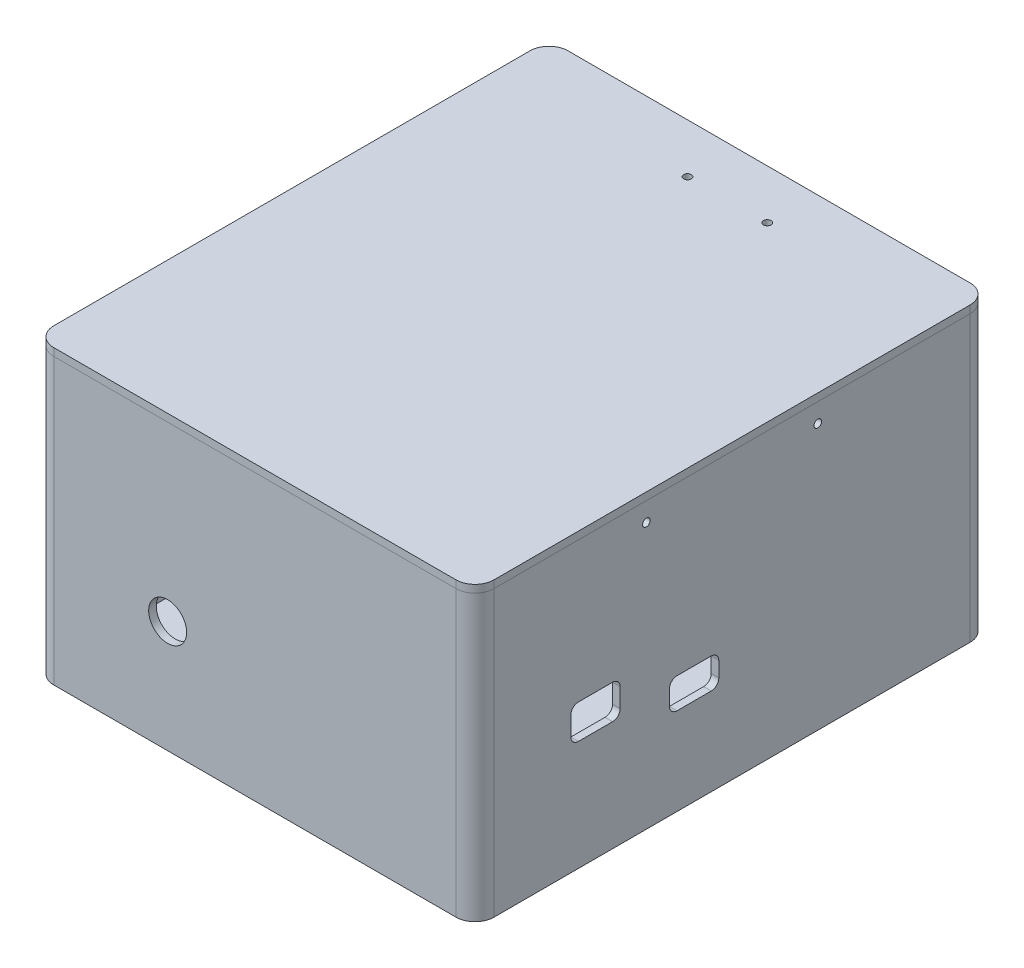
from build123d import *

# Parameters (mm, degrees)
SKETCH1_W               = 116
SKETCH1_H               = 135.5
SKETCH1_R               = 1.625
BOSS_EXTRUDE1_DEPTH     = 2
SKETCH3_W               = 116
SKETCH3_H               = 135.5
SKETCH3_W_2             = 112
SKETCH3_H_2             = 131.5
BOSS_EXTRUDE2_DEPTH     = 73
SKETCH5_W               = 13
SKETCH5_H               = 8
SKETCH5_H_2             = 9
CUT_EXTRUDE1_DEPTH      = 2
SKETCH8_R               = 5
CUT_EXTRUDE2_DEPTH      = 2
FILLET1_R               = 2
FILLET2_R               = 5
CUT_EXTRUDE3_DEPTH      = 136.639227364
CUT_EXTRUDE3_DEPTH_BACK = 136.639227364
SKETCH9_R               = 1
SKETCH10_R              = 4
CUT_EXTRUDE4_DEPTH      = 2
CUT_EXTRUDE5_DEPTH      = 2
BOSS_EXTRUDE4_DEPTH     = 2
SKETCH15_W              = 20
SKETCH15_H              = 29
BOSS_EXTRUDE5_DEPTH     = 2
SKETCH16_R              = 9.5
CUT_EXTRUDE6_DEPTH      = 2
SKETCH17_R              = 9.5
CUT_EXTRUDE7_DEPTH      = 2
SKETCH18_W              = 3
SKETCH18_H              = 75.5
BOSS_EXTRUDE6_DEPTH     = 10
BOSS_EXTRUDE6_2_DEPTH   = 10
SKETCH19_W              = 116
SKETCH19_H              = 135.5
BOSS_EXTRUDE7_DEPTH     = 2
FILLET3_R               = 5
SKETCH21_R              = 1
CUT_EXTRUDE8_DEPTH      = 2
CUT_EXTRUDE9_DEPTH      = 137.75525584
CUT_EXTRUDE9_DEPTH_BACK = 137.75525584
SKETCH22_R              = 1
SKETCH23_R              = 1
CUT_EXTRUDE10_DEPTH     = 2


with BuildPart() as part:
    # Sketch1 → Boss-Extrude1 (new body)
    with BuildSketch(Plane(origin=(0, 0, 0), x_dir=(1, 0, 0), z_dir=(0, 1, 0))):
        with Locations((0, 29.25)):
            Rectangle(SKETCH1_W, SKETCH1_H)
        with Locations(Location((-50.5, 29, 0), (0, 0, 270))):
            Circle(SKETCH1_R, mode=Mode.SUBTRACT)
        with Locations(Location((50.5, 29, 0), (0, 0, 270))):
            Circle(SKETCH1_R, mode=Mode.SUBTRACT)
        with Locations(Location((50.5, -29, 0), (0, 0, 270))):
            Circle(SKETCH1_R, mode=Mode.SUBTRACT)
        with Locations(Location((-50.5, -29, 0), (0, 0, 270))):
            Circle(SKETCH1_R, mode=Mode.SUBTRACT)
    extrude(amount=BOSS_EXTRUDE1_DEPTH)

    # Sketch3 → Boss-Extrude2 (add)
    with BuildSketch(Plane(origin=(0, 2, 0), x_dir=(1, 0, 0), z_dir=(0, 1, 0))):
        with Locations((0, 29.25)):
            Rectangle(SKETCH3_W, SKETCH3_H)
        with Locations((0, 29.25)):
            Rectangle(SKETCH3_W_2, SKETCH3_H_2, mode=Mode.SUBTRACT)
    extrude(amount=BOSS_EXTRUDE2_DEPTH)

    # Sketch5 → Cut-Extrude1 (cut)
    with BuildSketch(Plane(origin=(58, 0, 0), x_dir=(0, 0, -1), z_dir=(1, 0, 0))):
        with Locations((19.25, 27)):
            Rectangle(SKETCH5_W, SKETCH5_H)
        with Locations((-6.75, 33.5)):
            Rectangle(SKETCH5_W, SKETCH5_H_2)
    extrude(amount=-CUT_EXTRUDE1_DEPTH, mode=Mode.SUBTRACT)

    # Sketch8 → Cut-Extrude2 (cut)
    with BuildSketch(Plane.XY.offset(38.5)):
        with Locations((-23, 29.5)):
            Circle(SKETCH8_R)
    extrude(amount=-CUT_EXTRUDE2_DEPTH, mode=Mode.SUBTRACT)

    # Fillet1
    fillet1_edges = [part.edges().sort_by_distance(p)[0] for p in [
        (57, 31, -12.75),
        (57, 23, -12.75),
        (57, 23, -25.75),
        (57, 31, -25.75),
        (57, 38, 13.25),
        (57, 29, 13.25),
        (57, 29, 0.25),
        (57, 38, 0.25),
    ]]
    fillet(fillet1_edges, radius=FILLET1_R)

    # Fillet2
    fillet2_edges = [part.edges().sort_by_distance(p)[0] for p in [
        (56, 38.5, -95),
        (56, 38.5, 36.5),
        (-56, 38.5, 36.5),
        (-56, 38.5, -95),
        (-58, 37.5, -97),
        (58, 37.5, -97),
        (58, 37.5, 38.5),
        (-58, 37.5, 38.5),
    ]]
    fillet(fillet2_edges, radius=FILLET2_R)

    # Sketch9 → Cut-Extrude3 (cut, two sides: drawn at the far end of the back side and taken through both)
    with BuildSketch(Plane(origin=(0, 0, 0), x_dir=(0, 0, -1), z_dir=(1, 0, 0)).offset(-CUT_EXTRUDE3_DEPTH_BACK)):
        with Locations((6.666666667, 70)):
            Circle(SKETCH9_R)
        with Locations((51.833333333, 70)):
            Circle(SKETCH9_R)
    extrude(amount=CUT_EXTRUDE3_DEPTH + CUT_EXTRUDE3_DEPTH_BACK, mode=Mode.SUBTRACT)

    # Sketch10 → Cut-Extrude4 (cut)
    with BuildSketch(Plane(origin=(0, 0, -97), x_dir=(-1, 0, 0), z_dir=(0, 0, -1))):
        with Locations((-2, 44)):
            Circle(SKETCH10_R)
    extrude(amount=-CUT_EXTRUDE4_DEPTH, mode=Mode.SUBTRACT)

    # Sketch12 → Cut-Extrude5 (cut)
    with BuildSketch(Plane(origin=(0, 0, -97), x_dir=(-1, 0, 0), z_dir=(0, 0, -1))):
        Polygon((-15, 75), (-15, 73.5), (-10, 73.5), (-10, 66), (6, 66), (6, 73.5), (11, 73.5), (11, 75), align=None)
    extrude(amount=-CUT_EXTRUDE5_DEPTH, mode=Mode.SUBTRACT)

    # Sketch14 → Boss-Extrude4 (add)
    with BuildSketch(Plane.XY.offset(-95)):
        Polygon((-48, 31), (-48, 5), (-34, 5), (-34, 31), (-31, 31), (-31, 2), (-51, 2), (-51, 31), align=None)
    extrude(amount=BOSS_EXTRUDE4_DEPTH)

    # Sketch15 → Boss-Extrude5 (add)
    with BuildSketch(Plane.XY.offset(-93)):
        with Locations((-41, 16.5)):
            Rectangle(SKETCH15_W, SKETCH15_H)
    extrude(amount=BOSS_EXTRUDE5_DEPTH)

    # Sketch16 → Cut-Extrude6 (cut)
    with BuildSketch(Plane(origin=(0, 0, -97), x_dir=(-1, 0, 0), z_dir=(0, 0, -1))):
        with Locations((-35, 60)):
            Circle(SKETCH16_R)
    extrude(amount=-CUT_EXTRUDE6_DEPTH, mode=Mode.SUBTRACT)

    # Sketch17 → Cut-Extrude7 (cut)
    with BuildSketch(Plane(origin=(0, 0, -97), x_dir=(-1, 0, 0), z_dir=(0, 0, -1))):
        with Locations((35, 60)):
            Circle(SKETCH17_R)
    extrude(amount=-CUT_EXTRUDE7_DEPTH, mode=Mode.SUBTRACT)


with BuildPart() as body_2:
    # Sketch18 → Boss-Extrude6 (new body)
    with BuildSketch(Plane(origin=(0, 75, 0), x_dir=(1, 0, 0), z_dir=(0, 1, 0))):
        with Locations((-54.5, 29.25)):
            Rectangle(SKETCH18_W, SKETCH18_H)
    extrude(amount=-BOSS_EXTRUDE6_DEPTH)

    # Sketch19 → Boss-Extrude7 (add)
    with BuildSketch(Plane(origin=(0, 75, 0), x_dir=(1, 0, 0), z_dir=(0, 1, 0))):
        with Locations((0, 29.25)):
            Rectangle(SKETCH19_W, SKETCH19_H)
    extrude(amount=BOSS_EXTRUDE7_DEPTH)

    # Fillet3
    fillet3_edges = [body_2.edges().sort_by_distance(p)[0] for p in [
        (58, 76, 38.5),
        (58, 76, -97),
        (-58, 76, -97),
        (-58, 76, 38.5),
    ]]
    fillet(fillet3_edges, radius=FILLET3_R)

    # Sketch21 → Cut-Extrude8 (cut)
    with BuildSketch(Plane.XZ.offset(-75)):
        with Locations(Location((12.5, -84, 0), (0, 0, 270))):
            Circle(SKETCH21_R)
        with Locations(Location((-8.5, -84, 0), (0, 0, 270))):
            Circle(SKETCH21_R)
    extrude(amount=-CUT_EXTRUDE8_DEPTH, mode=Mode.SUBTRACT)

    # Sketch22 → Cut-Extrude9 (cut, two sides: drawn at the far end of the back side and taken through both)
    with BuildSketch(Plane(origin=(0, 0, 0), x_dir=(0, 0, -1), z_dir=(1, 0, 0)).offset(-CUT_EXTRUDE9_DEPTH_BACK)):
        with Locations((6.666666667, 70)):
            Circle(SKETCH22_R)
        with Locations((51.833333333, 70)):
            Circle(SKETCH22_R)
    extrude(amount=CUT_EXTRUDE9_DEPTH + CUT_EXTRUDE9_DEPTH_BACK, mode=Mode.SUBTRACT)

    # Mirror1: body 2 across plane


with BuildPart() as body_3:
    # Sketch18 → Boss-Extrude6 2 (new body)
    with BuildSketch(Plane(origin=(0, 75, 0), x_dir=(1, 0, 0), z_dir=(0, 1, 0))):
        with Locations((54.5, 29.25)):
            Rectangle(SKETCH18_W, SKETCH18_H)
    extrude(amount=-BOSS_EXTRUDE6_2_DEPTH)


with BuildPart() as body_2_1:
    add(body_2.part)
    add(body_2.part.mirror(Plane(origin=(0, 0, 0), x_dir=(0, 0, 1), z_dir=(1, 0, 0))))

    # Sketch23 → Cut-Extrude10 (cut)
    with BuildSketch(Plane.XZ.offset(-75)):
        with Locations(Location((-8.5, -84, 0), (0, 0, 270))):
            Circle(SKETCH23_R)
        with Locations(Location((12.5, -84, 0), (0, 0, 270))):
            Circle(SKETCH23_R)
    extrude(amount=-CUT_EXTRUDE10_DEPTH, mode=Mode.SUBTRACT)


solid = Compound([part.part, body_3.part, body_2_1.part])
